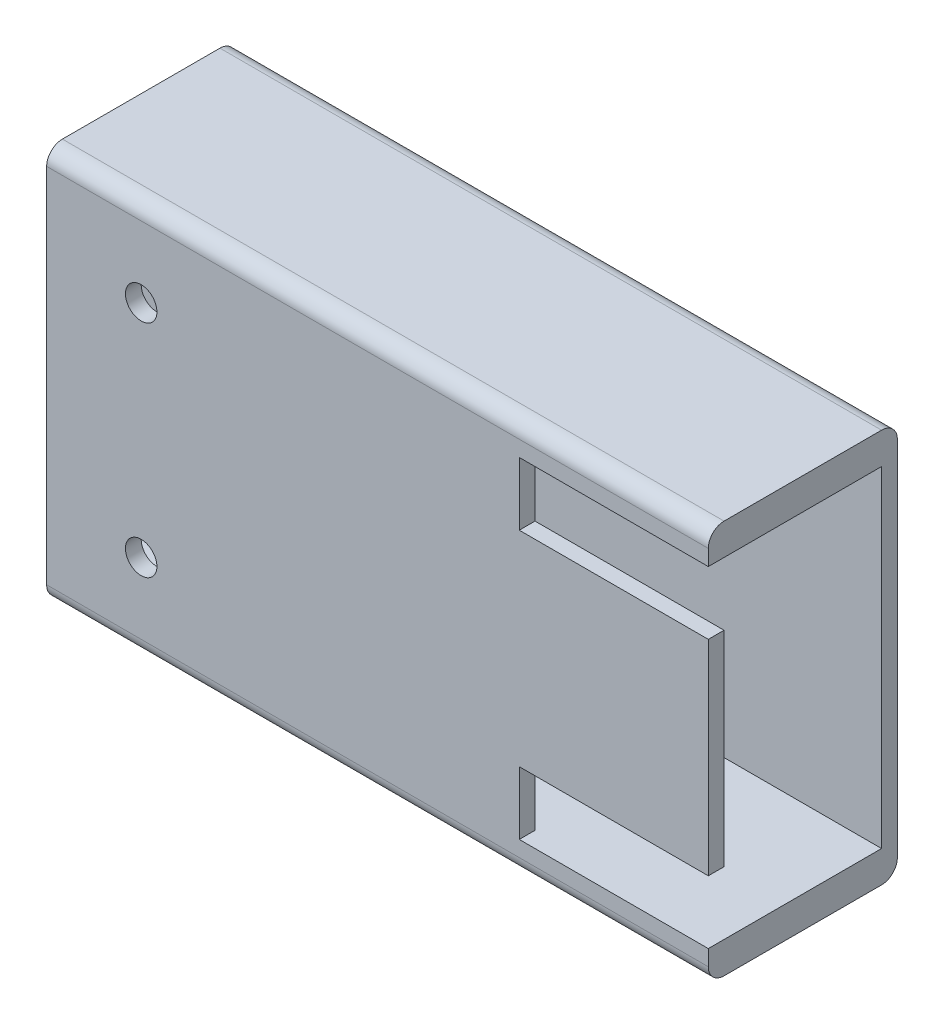
from build123d import *

# Parameters (mm, degrees)
SKETCH_1_W               = 42
SKETCH_1_H               = 25
EXTRUDE_1_DEPTH          = 12
SKETCH_3_W               = 10
SKETCH_3_H               = 21
CUT_EXTRUDE_1_DEPTH      = 41
SKETCH_4_W               = 5
SKETCH_4_H               = 10
CUT_EXTRUDE_2_DEPTH      = 10
SKETCH_5_W               = 12
SKETCH_5_H               = 4
CUT_EXTRUDE_3_DEPTH      = 10
CUT_EXTRUDE_4_DEPTH      = 10
CUT_EXTRUDE_4_DEPTH_BACK = 10
SKETCH_6_R               = 1
FILLET_1_R               = 1


with BuildPart() as part:
    # 草图1 → 凸台-拉伸1 (new body)
    with BuildSketch(Plane.XY):
        Rectangle(SKETCH_1_W, SKETCH_1_H)
    extrude(amount=EXTRUDE_1_DEPTH)

    # 草图3 → 切除-拉伸1 (cut)
    with BuildSketch(Plane(origin=(21, 0, 0), x_dir=(0, 0, -1), z_dir=(1, 0, 0))):
        with Locations((-6, 0)):
            Rectangle(SKETCH_3_W, SKETCH_3_H)
    extrude(amount=-CUT_EXTRUDE_1_DEPTH, mode=Mode.SUBTRACT)

    # 草图4 → 切除-拉伸2 (cut)
    with BuildSketch(Plane(origin=(-20, 0, 0), x_dir=(0, 0, -1), z_dir=(1, 0, 0))):
        with Locations((-8.5, 0)):
            Rectangle(SKETCH_4_W, SKETCH_4_H)
    extrude(amount=-CUT_EXTRUDE_2_DEPTH, mode=Mode.SUBTRACT)

    # 草图5 → 切除-拉伸3 (cut)
    with BuildSketch(Plane.XY.offset(12)):
        with Locations((15, 8.5)):
            Rectangle(SKETCH_5_W, SKETCH_5_H)
        with Locations((15, -8.5)):
            Rectangle(SKETCH_5_W, SKETCH_5_H)
    extrude(amount=-CUT_EXTRUDE_3_DEPTH, mode=Mode.SUBTRACT)

    # 草图6 → 切除-拉伸4 (cut, two sides: drawn at the far end of the back side and taken through both)
    with BuildSketch(Plane.XY.offset(12).offset(-CUT_EXTRUDE_4_DEPTH_BACK)):
        with Locations((-15, 7)):
            Circle(SKETCH_6_R)
        with Locations((-15, -7)):
            Circle(SKETCH_6_R)
    extrude(amount=CUT_EXTRUDE_4_DEPTH + CUT_EXTRUDE_4_DEPTH_BACK, mode=Mode.SUBTRACT)

    # 圆角1
    fillet_1_edges = [part.edges().sort_by_distance(p)[0] for p in [
        (0, -12.5, 0),
        (0, -12.5, 12),
        (0, 12.5, 0),
        (0, 12.5, 12),
    ]]
    fillet(fillet_1_edges, radius=FILLET_1_R)


solid = part.part
